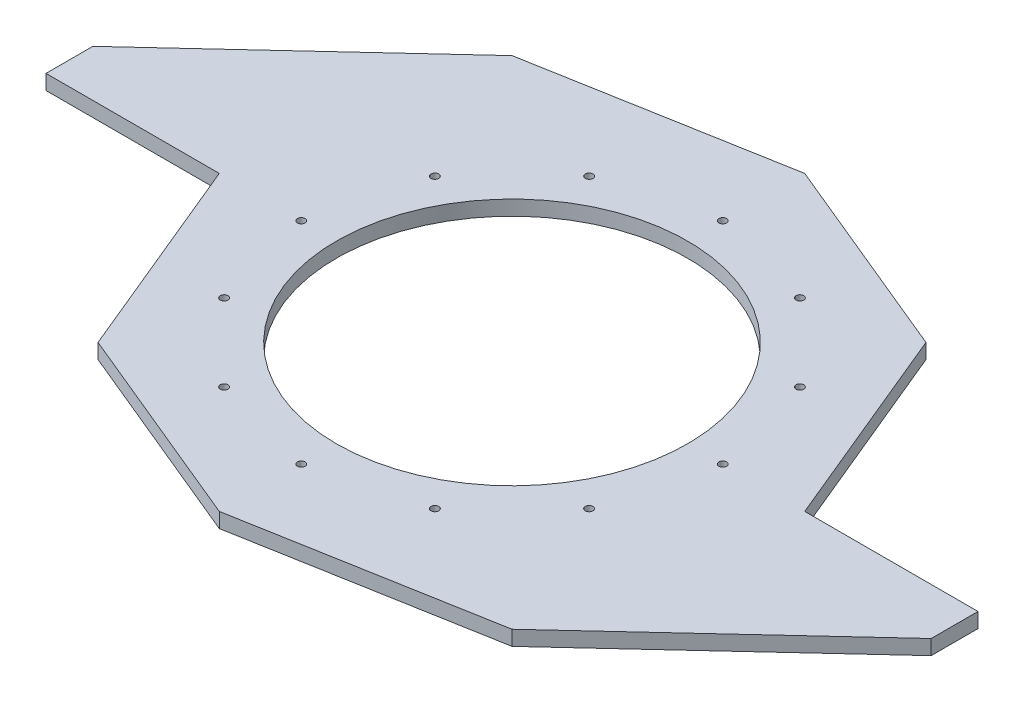
from build123d import *

# Parameters (mm, degrees)
SKETCH1_R                      = 75
BOSS_EXTRUDE1_DEPTH            = 6.35
CBORE_FOR_M3_SHCS1_D           = 3.3
CBORE_FOR_M3_SHCS1_CBORE_D     = 6
CBORE_FOR_M3_SHCS1_CBORE_DEPTH = 3


with BuildPart() as part:
    # Sketch1 → Boss-Extrude1 (new body)
    with BuildSketch(Plane(origin=(0, 0, 0), x_dir=(1, 0, 0), z_dir=(0, 1, 0))):
        Polygon((125, 0), (88.388347648, 88.388347648), (0, 125), (-106.066017178, 106.066017178), (-198.997487421, 20), (-198.997487421, 0), (-125, 0), (-88.388347648, -88.388347648), (0, -125), (106.066017178, -106.066017178), (198.997487421, -20), (198.997487421, 0), align=None)
        with Locations(Location((0, 0, 0), (0, 0, 270))):
            Circle(SKETCH1_R, mode=Mode.SUBTRACT)
    extrude(amount=BOSS_EXTRUDE1_DEPTH)

    # CBORE for M3 SHCS1 (through all)
    with Locations(Plane.XZ):
        with Locations((90, 0), (77.942286341, 45), (45, 77.942286341), (0, 90), (-45, 77.942286341), (-77.942286341, 45), (-90, 0), (-77.942286341, -45), (-45, -77.942286341), (0, -90), (45, -77.942286341), (77.942286341, -45), (0, 0)):
            CounterBoreHole(CBORE_FOR_M3_SHCS1_D / 2, CBORE_FOR_M3_SHCS1_CBORE_D / 2, CBORE_FOR_M3_SHCS1_CBORE_DEPTH)


solid = part.part
